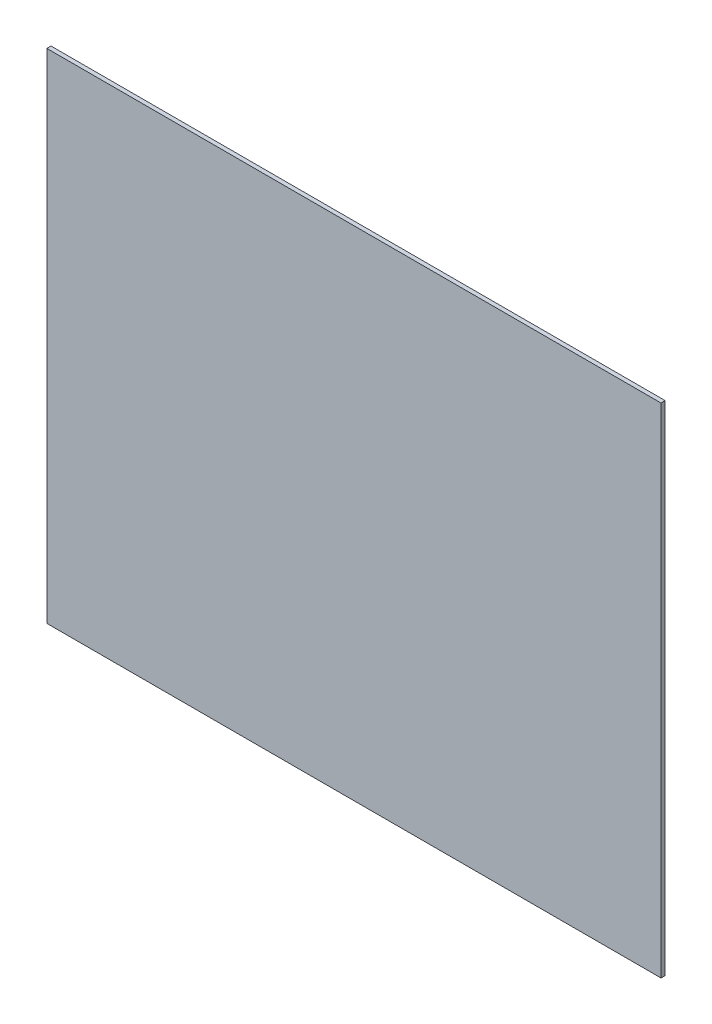
from build123d import *

# Parameters (mm, degrees)
SKETCH1_W           = 469.9
SKETCH1_H           = 381
BOSS_EXTRUDE1_DEPTH = 3.175


with BuildPart() as part:
    # Sketch1 → Boss-Extrude1 (new body)
    with BuildSketch(Plane.XY):
        Rectangle(SKETCH1_W, SKETCH1_H)
    extrude(amount=BOSS_EXTRUDE1_DEPTH)


solid = part.part
